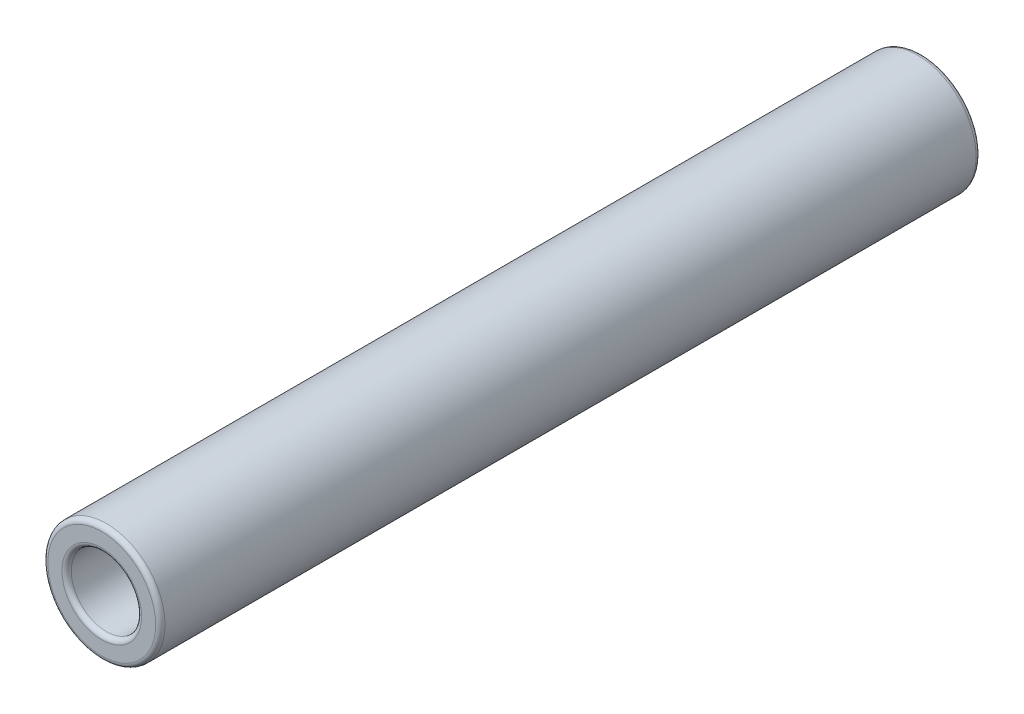
from build123d import *


with BuildPart() as part:
    # Croquis1 → Revolución1 (revolve)
    with BuildSketch(Plane(origin=(0, 0, 0), x_dir=(1, 0, 0), z_dir=(0, 1, 0))):
        with BuildLine():
            Line((1.5, 17.3), (1.5, -17.3))
            ThreePointArc((1.5, -17.3), (1.558578644, -17.441421356), (1.7, -17.5))
            Line((1.7, -17.5), (2.3, -17.5))
            ThreePointArc((2.3, -17.5), (2.441421356, -17.441421356), (2.5, -17.3))
            Line((2.5, -17.3), (2.5, 17.3))
            ThreePointArc((2.5, 17.3), (2.441421356, 17.441421356), (2.3, 17.5))
            Line((2.3, 17.5), (1.7, 17.5))
            ThreePointArc((1.7, 17.5), (1.558578644, 17.441421356), (1.5, 17.3))
        make_face()
    revolve(axis=Axis((0, 0, -17.502531008), (0, 0, 1)))


solid = part.part
